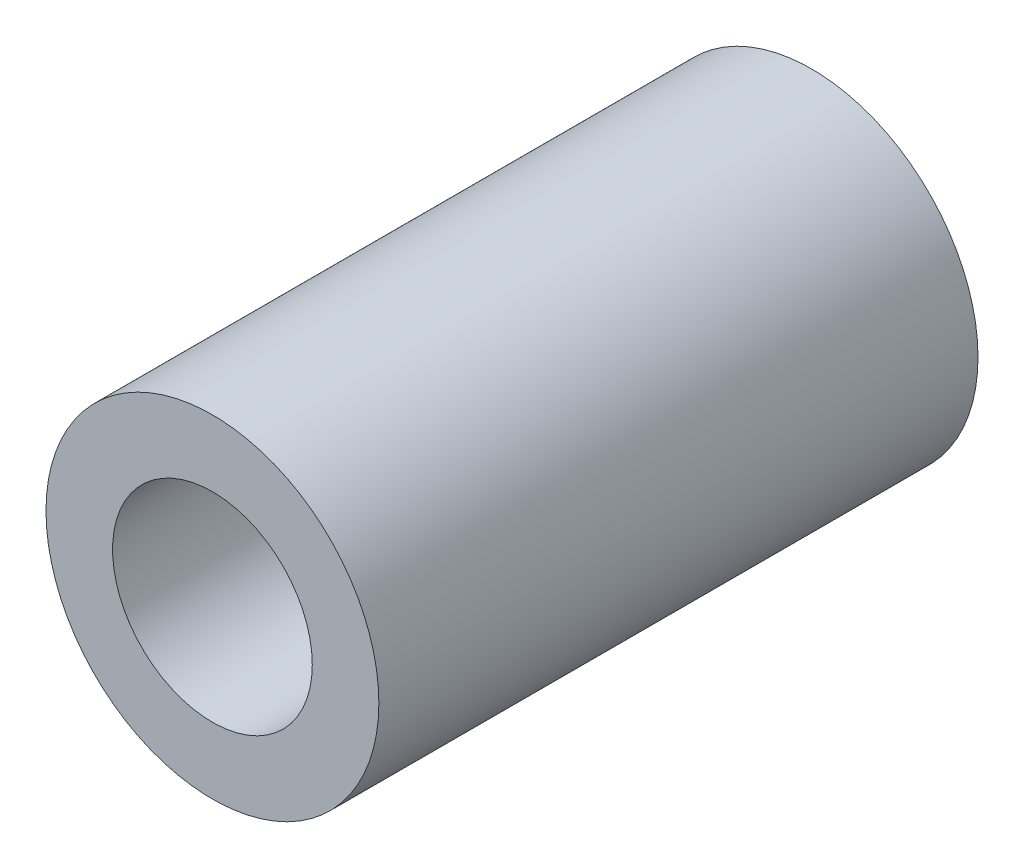
from build123d import *

# Parameters (mm, degrees)
SKETCH_1_R      = 5
SKETCH_1_R_2    = 3
EXTRUDE_1_DEPTH = 18


with BuildPart() as part:
    # 草图1 → 凸台-拉伸1 (new body)
    with BuildSketch(Plane.XY):
        Circle(SKETCH_1_R)
        Circle(SKETCH_1_R_2, mode=Mode.SUBTRACT)
    extrude(amount=EXTRUDE_1_DEPTH)


solid = part.part
